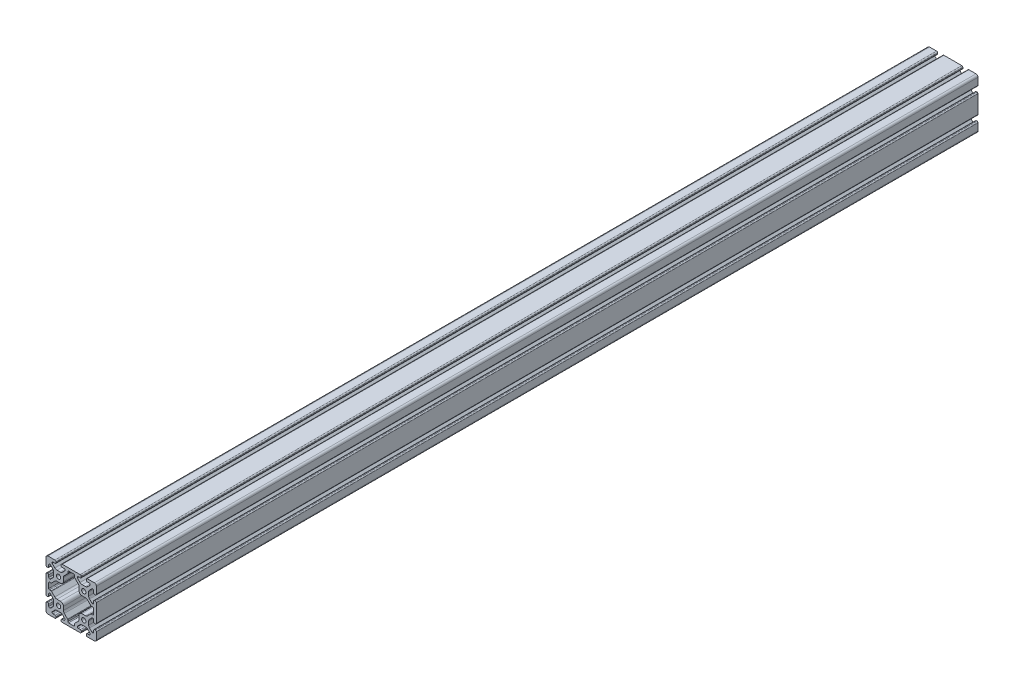
from build123d import *

# Parameters (mm, degrees)
SKETCH1_R      = 3.4
EXTRUDE1_DEPTH = 1400


with BuildPart() as part:
    # Sketch1 → Extrude1 (new body)
    with BuildSketch(Plane.XY):
        with BuildLine():
            Line((29.091242789, 26.036541495), (33.082657296, 30.027956002))
            ThreePointArc((33.082657296, 30.027956002), (33.329219041, 30.192703293), (33.62005845, 30.250554848))
            Line((33.62005845, 30.250554848), (33.955571436, 30.250554848))
            ThreePointArc((33.955571436, 30.250554848), (35.065729082, 29.790712494), (35.525571436, 28.680554848))
            Line((35.525571436, 28.680554848), (35.525571436, 25.777866899))
            ThreePointArc((35.525571436, 25.777866899), (35.985413789, 24.667709253), (37.095571436, 24.207866899))
            Line((37.095571436, 24.207866899), (38.43, 24.207866899))
            ThreePointArc((38.43, 24.207866899), (39.540157646, 24.667709253), (40, 25.777866899))
            Line((40, 25.777866899), (40, 32.933852749))
            Line((40, 32.933852749), (40, 36.83))
            ThreePointArc((40, 36.83), (39.071528496, 39.071528496), (36.83, 40))
            Line((36.83, 40), (25.540851266, 40))
            ThreePointArc((25.540851266, 40), (24.43069362, 39.540157646), (23.970851266, 38.43))
            Line((23.970851266, 38.43), (23.970851266, 37.249043598))
            ThreePointArc((23.970851266, 37.249043598), (24.43069362, 36.138885952), (25.540851266, 35.679043598))
            Line((25.540851266, 35.679043598), (28.625762638, 35.679043598))
            ThreePointArc((28.625762638, 35.679043598), (29.77116849, 35.239363487), (30.250554848, 34.11))
            Line((30.250554848, 34.11), (30.250554848, 33.62005845))
            ThreePointArc((30.250554848, 33.62005845), (30.192703293, 33.329219041), (30.027956002, 33.082657296))
            Line((30.027956002, 33.082657296), (26.036541495, 29.091242789))
            ThreePointArc((26.036541495, 29.091242789), (24.495530588, 28.061572221), (22.677784284, 27.7))
            Line((22.677784284, 27.7), (17.322215716, 27.7))
            ThreePointArc((17.322215716, 27.7), (15.504469412, 28.061572221), (13.963458505, 29.091242789))
            Line((13.963458505, 29.091242789), (9.90393336, 33.150767934))
            ThreePointArc((9.90393336, 33.150767934), (9.764102181, 33.360040084), (9.715, 33.606893415))
            Line((9.715, 33.606893415), (9.715, 34.096834965))
            ThreePointArc((9.715, 34.096834965), (10.178698303, 35.216301697), (11.298165035, 35.68))
            Line((11.298165035, 35.68), (14.642754087, 35.68))
            ThreePointArc((14.642754087, 35.68), (15.560045469, 36.059954531), (15.94, 36.977245913))
            Line((15.94, 36.977245913), (15.94, 38.194841282))
            ThreePointArc((15.94, 38.194841282), (15.411281253, 39.471281253), (14.134841282, 40))
            Line((14.134841282, 40), (6.984433948, 40))
            Line((6.984433948, 40), (-6.984433948, 40))
            Line((-6.984433948, 40), (-14.134841282, 40))
            ThreePointArc((-14.134841282, 40), (-15.411281253, 39.471281253), (-15.94, 38.194841282))
            Line((-15.94, 38.194841282), (-15.94, 36.977245913))
            ThreePointArc((-15.94, 36.977245913), (-15.560045469, 36.059954531), (-14.642754087, 35.68))
            Line((-14.642754087, 35.68), (-11.298165035, 35.68))
            ThreePointArc((-11.298165035, 35.68), (-10.178698303, 35.216301697), (-9.715, 34.096834965))
            Line((-9.715, 34.096834965), (-9.715, 33.606893415))
            ThreePointArc((-9.715, 33.606893415), (-9.764102181, 33.360040084), (-9.90393336, 33.150767934))
            Line((-9.90393336, 33.150767934), (-13.963458505, 29.091242789))
            ThreePointArc((-13.963458505, 29.091242789), (-15.504469412, 28.061572221), (-17.322215716, 27.7))
            Line((-17.322215716, 27.7), (-22.677784284, 27.7))
            ThreePointArc((-22.677784284, 27.7), (-24.495530588, 28.061572221), (-26.036541495, 29.091242789))
            Line((-26.036541495, 29.091242789), (-30.09606664, 33.150767934))
            ThreePointArc((-30.09606664, 33.150767934), (-30.235897819, 33.360040084), (-30.285, 33.606893415))
            Line((-30.285, 33.606893415), (-30.285, 34.096834965))
            ThreePointArc((-30.285, 34.096834965), (-29.821301697, 35.216301697), (-28.701834965, 35.68))
            Line((-28.701834965, 35.68), (-25.357245913, 35.68))
            ThreePointArc((-25.357245913, 35.68), (-24.439954531, 36.059954531), (-24.06, 36.977245913))
            Line((-24.06, 36.977245913), (-24.06, 38.194841282))
            ThreePointArc((-24.06, 38.194841282), (-24.588718747, 39.471281253), (-25.865158718, 40))
            Line((-25.865158718, 40), (-33.031395847, 40))
            Line((-33.031395847, 40), (-36.83, 40))
            ThreePointArc((-36.83, 40), (-39.071528496, 39.071528496), (-40, 36.83))
            Line((-40, 36.83), (-40, 33.318079463))
            Line((-40, 33.318079463), (-40, 25.865158718))
            ThreePointArc((-40, 25.865158718), (-39.471281253, 24.588718747), (-38.194841282, 24.06))
            Line((-38.194841282, 24.06), (-36.977245913, 24.06))
            ThreePointArc((-36.977245913, 24.06), (-36.059954531, 24.439954531), (-35.68, 25.357245913))
            Line((-35.68, 25.357245913), (-35.68, 28.680554848))
            ThreePointArc((-35.68, 28.680554848), (-35.220157646, 29.790712494), (-34.11, 30.250554848))
            Line((-34.11, 30.250554848), (-33.62005845, 30.250554848))
            ThreePointArc((-33.62005845, 30.250554848), (-33.329219041, 30.192703293), (-33.082657296, 30.027956002))
            Line((-33.082657296, 30.027956002), (-29.091242789, 26.036541495))
            ThreePointArc((-29.091242789, 26.036541495), (-28.061572221, 24.495530588), (-27.7, 22.677784284))
            Line((-27.7, 22.677784284), (-27.7, 17.322215716))
            ThreePointArc((-27.7, 17.322215716), (-28.061572221, 15.504469412), (-29.091242789, 13.963458505))
            Line((-29.091242789, 13.963458505), (-33.082657296, 9.972043998))
            ThreePointArc((-33.082657296, 9.972043998), (-33.329219041, 9.807296707), (-33.62005845, 9.749445152))
            Line((-33.62005845, 9.749445152), (-34.11, 9.749445152))
            ThreePointArc((-34.11, 9.749445152), (-35.220157646, 10.209287506), (-35.68, 11.319445152))
            Line((-35.68, 11.319445152), (-35.68, 14.642754087))
            ThreePointArc((-35.68, 14.642754087), (-36.059954531, 15.560045469), (-36.977245913, 15.94))
            Line((-36.977245913, 15.94), (-38.194841282, 15.94))
            ThreePointArc((-38.194841282, 15.94), (-39.471281253, 15.411281253), (-40, 14.134841282))
            Line((-40, 14.134841282), (-40, 7.016888977))
            Line((-40, 7.016888977), (-40, -7.016888977))
            Line((-40, -7.016888977), (-40, -14.447338303))
            ThreePointArc((-40, -14.447338303), (-39.540157646, -15.557495949), (-38.43, -16.017338303))
            Line((-38.43, -16.017338303), (-37.25, -16.017338303))
            ThreePointArc((-37.25, -16.017338303), (-36.139842354, -15.557495949), (-35.68, -14.447338303))
            Line((-35.68, -14.447338303), (-35.68, -11.319445152))
            ThreePointArc((-35.68, -11.319445152), (-35.220157646, -10.209287506), (-34.11, -9.749445152))
            Line((-34.11, -9.749445152), (-33.62005845, -9.749445152))
            ThreePointArc((-33.62005845, -9.749445152), (-33.329219041, -9.807296707), (-33.082657296, -9.972043998))
            Line((-33.082657296, -9.972043998), (-29.091242789, -13.963458505))
            ThreePointArc((-29.091242789, -13.963458505), (-28.061572221, -15.504469412), (-27.7, -17.322215716))
            Line((-27.7, -17.322215716), (-27.7, -22.677784284))
            ThreePointArc((-27.7, -22.677784284), (-28.061572221, -24.495530588), (-29.091242789, -26.036541495))
            Line((-29.091242789, -26.036541495), (-32.871776968, -29.817075674))
            ThreePointArc((-32.871776968, -29.817075674), (-33.10612883, -29.976640176), (-33.382654504, -30.039211548))
            Line((-33.382654504, -30.039211548), (-34.05520779, -30.062697627))
            ThreePointArc((-34.05520779, -30.062697627), (-35.200613642, -29.623017515), (-35.68, -28.493654028))
            Line((-35.68, -28.493654028), (-35.68, -25.59096608))
            ThreePointArc((-35.68, -25.59096608), (-36.139842354, -24.480808433), (-37.25, -24.02096608))
            Line((-37.25, -24.02096608), (-38.43, -24.02096608))
            ThreePointArc((-38.43, -24.02096608), (-39.540157646, -24.480808433), (-40, -25.59096608))
            Line((-40, -25.59096608), (-40, -33.019082273))
            Line((-40, -33.019082273), (-40, -36.83))
            ThreePointArc((-40, -36.83), (-39.071528496, -39.071528496), (-36.83, -40))
            Line((-36.83, -40), (-33, -40))
            Line((-33, -40), (-25.72307469, -40))
            ThreePointArc((-25.72307469, -40), (-24.612917043, -39.540157646), (-24.15307469, -38.43))
            Line((-24.15307469, -38.43), (-24.15307469, -37.25))
            ThreePointArc((-24.15307469, -37.25), (-24.612917043, -36.139842354), (-25.72307469, -35.68))
            Line((-25.72307469, -35.68), (-28.680554848, -35.68))
            ThreePointArc((-28.680554848, -35.68), (-29.790712494, -35.220157646), (-30.250554848, -34.11))
            Line((-30.250554848, -34.11), (-30.250554848, -33.62005845))
            ThreePointArc((-30.250554848, -33.62005845), (-30.192703293, -33.329219041), (-30.027956002, -33.082657296))
            Line((-30.027956002, -33.082657296), (-26.036541495, -29.091242789))
            ThreePointArc((-26.036541495, -29.091242789), (-24.495530588, -28.061572221), (-22.677784284, -27.7))
            Line((-22.677784284, -27.7), (-17.322215716, -27.7))
            ThreePointArc((-17.322215716, -27.7), (-15.504469412, -28.061572221), (-13.963458505, -29.091242789))
            Line((-13.963458505, -29.091242789), (-10.203784275, -32.85091702))
            ThreePointArc((-10.203784275, -32.85091702), (-10.044219772, -33.085268882), (-9.9816484, -33.361794556))
            Line((-9.9816484, -33.361794556), (-9.957433876, -34.05520779))
            ThreePointArc((-9.957433876, -34.05520779), (-10.397113988, -35.200613642), (-11.526477474, -35.68))
            Line((-11.526477474, -35.68), (-14.429165423, -35.68))
            ThreePointArc((-14.429165423, -35.68), (-15.539323069, -36.139842354), (-15.999165423, -37.25))
            Line((-15.999165423, -37.25), (-15.999165423, -38.43))
            ThreePointArc((-15.999165423, -38.43), (-15.539323069, -39.540157646), (-14.429165423, -40))
            Line((-14.429165423, -40), (-6.998716097, -40))
            Line((-6.998716097, -40), (6.998716097, -40))
            Line((6.998716097, -40), (14.424638994, -40))
            ThreePointArc((14.424638994, -40), (15.53479664, -39.540157646), (15.994638994, -38.43))
            Line((15.994638994, -38.43), (15.994638994, -37.032644306))
            ThreePointArc((15.994638994, -37.032644306), (15.53479664, -35.922486659), (14.424638994, -35.462644306))
            Line((14.424638994, -35.462644306), (11.382372282, -35.462644306))
            ThreePointArc((11.382372282, -35.462644306), (10.272214636, -35.002801952), (9.812372282, -33.892644306))
            Line((9.812372282, -33.892644306), (9.812372282, -33.55713132))
            ThreePointArc((9.812372282, -33.55713132), (9.870223837, -33.266291912), (10.034971128, -33.019730166))
            Line((10.034971128, -33.019730166), (13.963458505, -29.091242789))
            ThreePointArc((13.963458505, -29.091242789), (15.504469412, -28.061572221), (17.322215716, -27.7))
            Line((17.322215716, -27.7), (22.677784284, -27.7))
            ThreePointArc((22.677784284, -27.7), (24.495530588, -28.061572221), (26.036541495, -29.091242789))
            Line((26.036541495, -29.091242789), (29.794925243, -32.849626538))
            ThreePointArc((29.794925243, -32.849626538), (29.954489746, -33.083978399), (30.017061118, -33.360504074))
            Line((30.017061118, -33.360504074), (30.041320706, -34.05520779))
            ThreePointArc((30.041320706, -34.05520779), (29.601640594, -35.200613642), (28.472277108, -35.68))
            Line((28.472277108, -35.68), (25.569589159, -35.68))
            ThreePointArc((25.569589159, -35.68), (24.459431513, -36.139842354), (23.999589159, -37.25))
            Line((23.999589159, -37.25), (23.999589159, -38.43))
            ThreePointArc((23.999589159, -38.43), (24.459431513, -39.540157646), (25.569589159, -40))
            Line((25.569589159, -40), (32.999849358, -40))
            Line((32.999849358, -40), (36.83, -40))
            ThreePointArc((36.83, -40), (39.071528496, -39.071528496), (40, -36.83))
            Line((40, -36.83), (40, -33.025941835))
            Line((40, -33.025941835), (40, -25.777866899))
            ThreePointArc((40, -25.777866899), (39.540157646, -24.667709253), (38.43, -24.207866899))
            Line((38.43, -24.207866899), (37.25, -24.207866899))
            ThreePointArc((37.25, -24.207866899), (36.139842354, -24.667709253), (35.68, -25.777866899))
            Line((35.68, -25.777866899), (35.68, -28.680554848))
            ThreePointArc((35.68, -28.680554848), (35.220157646, -29.790712494), (34.11, -30.250554848))
            Line((34.11, -30.250554848), (33.62005845, -30.250554848))
            ThreePointArc((33.62005845, -30.250554848), (33.329219041, -30.192703293), (33.082657296, -30.027956002))
            Line((33.082657296, -30.027956002), (29.091242789, -26.036541495))
            ThreePointArc((29.091242789, -26.036541495), (28.061572221, -24.495530588), (27.7, -22.677784284))
            Line((27.7, -22.677784284), (27.7, -17.322215716))
            ThreePointArc((27.7, -17.322215716), (28.061572221, -15.504469412), (29.091242789, -13.963458505))
            Line((29.091242789, -13.963458505), (33.082657296, -9.972043998))
            ThreePointArc((33.082657296, -9.972043998), (33.329219041, -9.807296707), (33.62005845, -9.749445152))
            Line((33.62005845, -9.749445152), (34.11, -9.749445152))
            ThreePointArc((34.11, -9.749445152), (35.220157646, -10.209287506), (35.68, -11.319445152))
            Line((35.68, -11.319445152), (35.68, -14.222133101))
            ThreePointArc((35.68, -14.222133101), (36.139842354, -15.332290747), (37.25, -15.792133101))
            Line((37.25, -15.792133101), (38.43, -15.792133101))
            ThreePointArc((38.43, -15.792133101), (39.540157646, -15.332290747), (40, -14.222133101))
            Line((40, -14.222133101), (40, -7.021415406))
            Line((40, -7.021415406), (40, 7.021415406))
            Line((40, 7.021415406), (40, 14.222133101))
            ThreePointArc((40, 14.222133101), (39.540157646, 15.332290747), (38.43, 15.792133101))
            Line((38.43, 15.792133101), (37.25, 15.792133101))
            ThreePointArc((37.25, 15.792133101), (36.139842354, 15.332290747), (35.68, 14.222133101))
            Line((35.68, 14.222133101), (35.68, 11.319445152))
            ThreePointArc((35.68, 11.319445152), (35.220157646, 10.209287506), (34.11, 9.749445152))
            Line((34.11, 9.749445152), (33.62005845, 9.749445152))
            ThreePointArc((33.62005845, 9.749445152), (33.329219041, 9.807296707), (33.082657296, 9.972043998))
            Line((33.082657296, 9.972043998), (29.091242789, 13.963458505))
            ThreePointArc((29.091242789, 13.963458505), (28.061572221, 15.504469412), (27.7, 17.322215716))
            Line((27.7, 17.322215716), (27.7, 22.677784284))
            ThreePointArc((27.7, 22.677784284), (28.061572221, 24.495530588), (29.091242789, 26.036541495))
        make_face()
        with Locations((-20, 20)):
            Circle(SKETCH1_R, mode=Mode.SUBTRACT)
        with Locations((20, 20)):
            Circle(SKETCH1_R, mode=Mode.SUBTRACT)
        with Locations((20, -20)):
            Circle(SKETCH1_R, mode=Mode.SUBTRACT)
        with Locations((-20, -20)):
            Circle(SKETCH1_R, mode=Mode.SUBTRACT)
        with BuildLine():
            Line((17.07, 12.32), (22.657784284, 12.32))
            ThreePointArc((22.657784284, 12.32), (24.475530588, 11.958427779), (26.016541495, 10.928757211))
            Line((26.016541495, 10.928757211), (31.143879165, 5.80141954))
            ThreePointArc((31.143879165, 5.80141954), (31.555896818, 5.526118146), (32.041904777, 5.429445152))
            Line((32.041904777, 5.429445152), (34.41, 5.429445152))
            ThreePointArc((34.41, 5.429445152), (35.308025612, 5.057470764), (35.68, 4.159445152))
            Line((35.68, 4.159445152), (35.68, -4.159445152))
            ThreePointArc((35.68, -4.159445152), (35.308025612, -5.057470764), (34.41, -5.429445152))
            Line((34.41, -5.429445152), (32.041904777, -5.429445152))
            ThreePointArc((32.041904777, -5.429445152), (31.555896818, -5.526118146), (31.143879165, -5.80141954))
            Line((31.143879165, -5.80141954), (26.016541495, -10.928757211))
            ThreePointArc((26.016541495, -10.928757211), (24.475530588, -11.958427779), (22.657784284, -12.32))
            Line((22.657784284, -12.32), (17.07, -12.32))
            ThreePointArc((17.07, -12.32), (13.711242789, -13.711242789), (12.32, -17.07))
            Line((12.32, -17.07), (12.32, -22.657784284))
            ThreePointArc((12.32, -22.657784284), (11.958427779, -24.475530588), (10.928757211, -26.016541495))
            Line((10.928757211, -26.016541495), (5.80141954, -31.143879165))
            ThreePointArc((5.80141954, -31.143879165), (5.526118146, -31.555896818), (5.429445152, -32.041904777))
            Line((5.429445152, -32.041904777), (5.429445152, -34.41))
            ThreePointArc((5.429445152, -34.41), (5.057470764, -35.308025612), (4.159445152, -35.68))
            Line((4.159445152, -35.68), (-4.159445152, -35.68))
            ThreePointArc((-4.159445152, -35.68), (-5.057470764, -35.308025612), (-5.429445152, -34.41))
            Line((-5.429445152, -34.41), (-5.429445152, -32.041904777))
            ThreePointArc((-5.429445152, -32.041904777), (-5.526118146, -31.555896818), (-5.80141954, -31.143879165))
            Line((-5.80141954, -31.143879165), (-10.928757211, -26.016541495))
            ThreePointArc((-10.928757211, -26.016541495), (-11.958427779, -24.475530588), (-12.32, -22.657784284))
            Line((-12.32, -22.657784284), (-12.32, -17.07))
            ThreePointArc((-12.32, -17.07), (-13.711242789, -13.711242789), (-17.07, -12.32))
            Line((-17.07, -12.32), (-22.657784284, -12.32))
            ThreePointArc((-22.657784284, -12.32), (-24.475530588, -11.958427779), (-26.016541495, -10.928757211))
            Line((-26.016541495, -10.928757211), (-31.143879165, -5.80141954))
            ThreePointArc((-31.143879165, -5.80141954), (-31.555896818, -5.526118146), (-32.041904777, -5.429445152))
            Line((-32.041904777, -5.429445152), (-34.41, -5.429445152))
            ThreePointArc((-34.41, -5.429445152), (-35.308025612, -5.057470764), (-35.68, -4.159445152))
            Line((-35.68, -4.159445152), (-35.68, 4.159445152))
            ThreePointArc((-35.68, 4.159445152), (-35.308025612, 5.057470764), (-34.41, 5.429445152))
            Line((-34.41, 5.429445152), (-32.041904777, 5.429445152))
            ThreePointArc((-32.041904777, 5.429445152), (-31.555896818, 5.526118146), (-31.143879165, 5.80141954))
            Line((-31.143879165, 5.80141954), (-26.016541495, 10.928757211))
            ThreePointArc((-26.016541495, 10.928757211), (-24.475530588, 11.958427779), (-22.657784284, 12.32))
            Line((-22.657784284, 12.32), (-17.07, 12.32))
            ThreePointArc((-17.07, 12.32), (-13.711242789, 13.711242789), (-12.32, 17.07))
            Line((-12.32, 17.07), (-12.32, 22.657784284))
            ThreePointArc((-12.32, 22.657784284), (-11.958427779, 24.475530588), (-10.928757211, 26.016541495))
            Line((-10.928757211, 26.016541495), (-5.80141954, 31.143879165))
            ThreePointArc((-5.80141954, 31.143879165), (-5.526118146, 31.555896818), (-5.429445152, 32.041904777))
            Line((-5.429445152, 32.041904777), (-5.429445152, 34.41))
            ThreePointArc((-5.429445152, 34.41), (-5.057470764, 35.308025612), (-4.159445152, 35.68))
            Line((-4.159445152, 35.68), (4.159445152, 35.68))
            ThreePointArc((4.159445152, 35.68), (5.057470764, 35.308025612), (5.429445152, 34.41))
            Line((5.429445152, 34.41), (5.429445152, 32.041904777))
            ThreePointArc((5.429445152, 32.041904777), (5.526118146, 31.555896818), (5.80141954, 31.143879165))
            Line((5.80141954, 31.143879165), (10.928757211, 26.016541495))
            ThreePointArc((10.928757211, 26.016541495), (11.958427779, 24.475530588), (12.32, 22.657784284))
            Line((12.32, 22.657784284), (12.32, 17.07))
            ThreePointArc((12.32, 17.07), (13.711242789, 13.711242789), (17.07, 12.32))
        make_face(mode=Mode.SUBTRACT)
    extrude(amount=-EXTRUDE1_DEPTH)


solid = part.part
